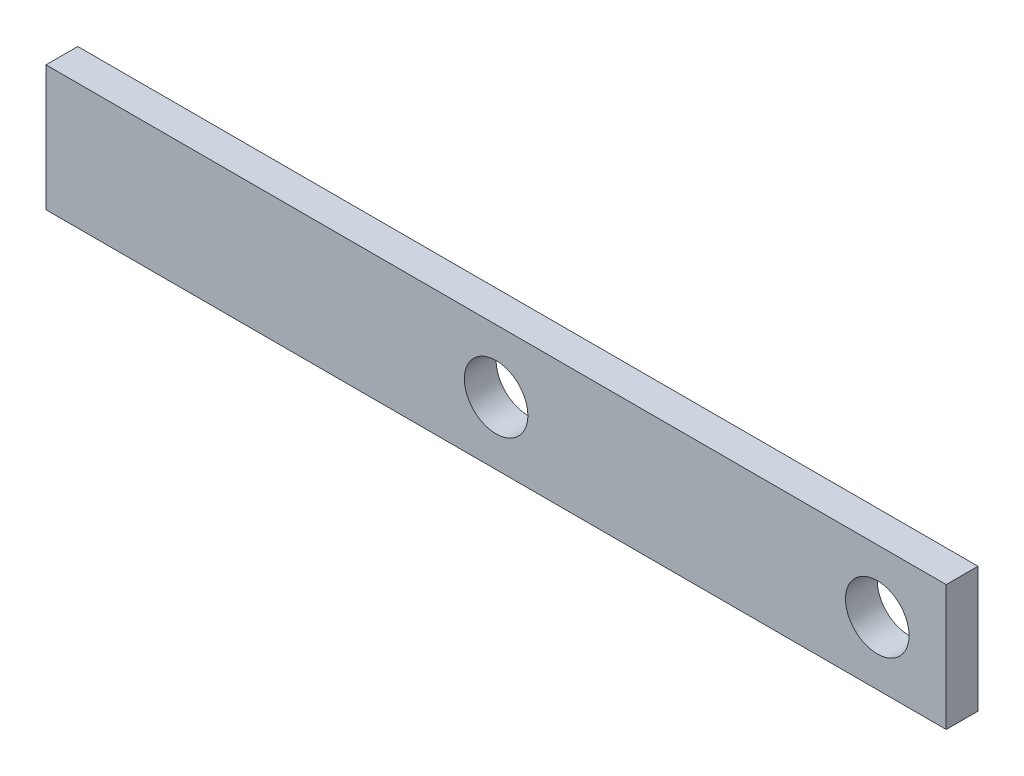
from build123d import *

# Parameters (mm, degrees)
CROQUIS1_W              = 283.41300437
CROQUIS1_H              = 39.51255033
CROQUIS1_R              = 10
SALIENTE_EXTRUIR1_DEPTH = 10


with BuildPart() as part:
    # Croquis1 → Saliente-Extruir1 (new body)
    with BuildSketch(Plane.XY):
        Rectangle(CROQUIS1_W, CROQUIS1_H)
        Circle(CROQUIS1_R, mode=Mode.SUBTRACT)
        with Locations((120, 0)):
            Circle(CROQUIS1_R, mode=Mode.SUBTRACT)
    extrude(amount=SALIENTE_EXTRUIR1_DEPTH)


solid = part.part
